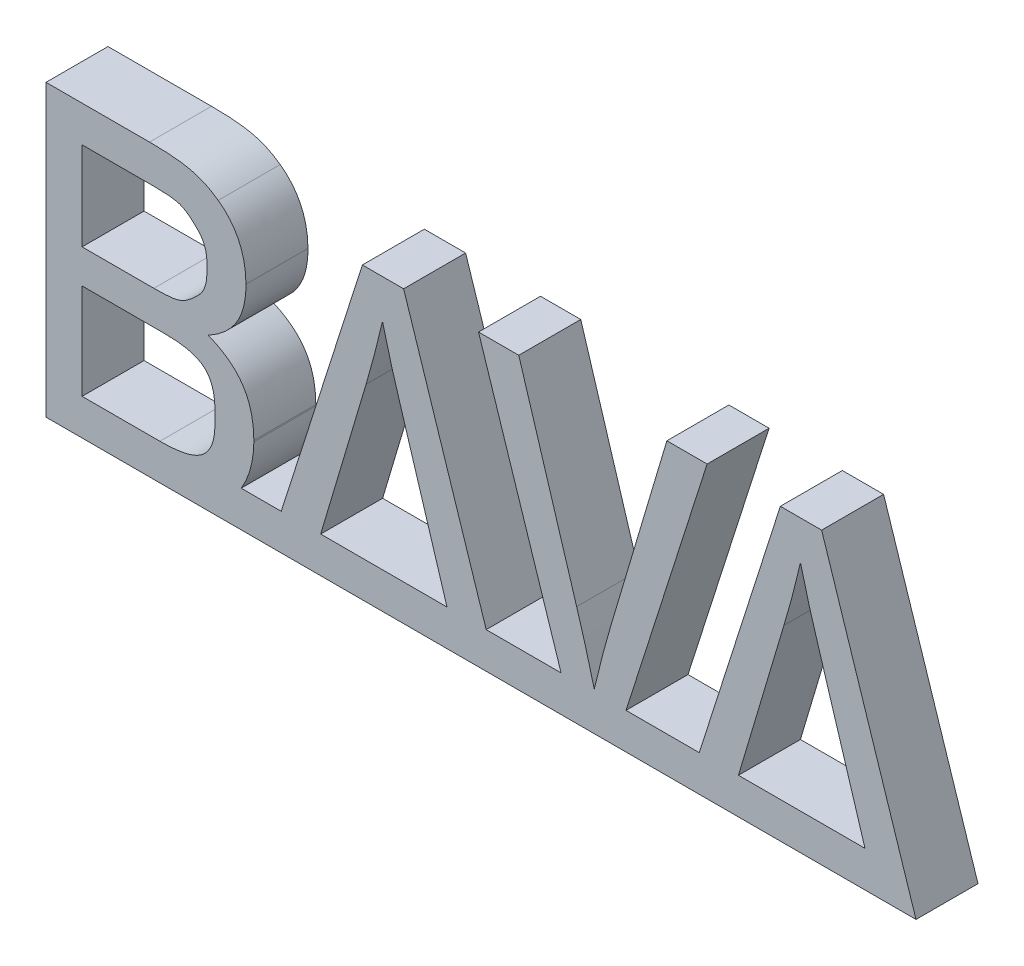
from build123d import *

# Parameters (mm, degrees)
BOSS_EXTRUDE1_DEPTH = 2


with BuildPart() as part:
    # Sketch1 → Boss-Extrude1 (new body)
    with BuildSketch(Plane.XY):
        with BuildLine():
            Line((-18.745582546, 31.006914048), (-21.79105099, 40.364252392))
            Line((-21.79105099, 40.364252392), (-23.123022137, 40.364252392))
            Line((-23.123022137, 40.364252392), (-25.740106044, 32.171592169))
            Line((-25.740106044, 32.171592169), (-28.102880037, 32.171592169))
            Line((-28.102880037, 32.171592169), (-25.485755278, 40.364252392))
            Line((-25.485755278, 40.364252392), (-26.78426782, 40.364252392))
            Line((-26.78426782, 40.364252392), (-28.598181785, 34.273274652))
            add(Edge.make_bspline(
                [(-28.598181785, 34.273274652), (-28.792274379, 33.597239241), (-28.906090832, 33.19565427), (-29.126942139, 32.251909163)],
                knots=[6, 6, 6, 6, 7, 7, 7, 7], degree=3))
            add(Edge.make_bspline(
                [(-29.126942139, 32.251909163), (-29.414792363, 33.316129761), (-29.448250968, 33.490163533), (-29.695901842, 34.273274652)],
                knots=[7, 7, 7, 7, 8, 8, 8, 8], degree=3))
            Line((-29.695901842, 34.273274652), (-31.563333235, 40.364252392))
            Line((-31.563333235, 40.364252392), (-32.861845777, 40.364252392))
            Line((-32.861845777, 40.364252392), (-30.197903482, 32.171592169))
            Line((-30.197903482, 32.171592169), (-32.614194903, 32.171592169))
            Line((-32.614194903, 32.171592169), (-35.278137198, 40.364252392))
            Line((-35.278137198, 40.364252392), (-36.610149199, 40.364252392))
            Line((-36.610149199, 40.364252392), (-39.227233105, 32.171592169))
            Line((-39.227233105, 32.171592169), (-40.519045756, 32.171592169))
            add(Edge.make_bspline(
                [(-40.519045756, 32.171592169), (-40.257995098, 32.593235961), (-40.110760894, 33.122037168), (-40.110760894, 33.69765591)],
                knots=[16, 16, 16, 16, 17, 17, 17, 17], degree=3))
            add(Edge.make_bspline(
                [(-40.110760894, 33.69765591), (-40.110760894, 34.82213468), (-40.572604036, 35.511569875), (-41.583307207, 35.913154846)],
                knots=[17, 17, 17, 17, 18, 18, 18, 18], degree=3))
            add(Edge.make_bspline(
                [(-41.583307207, 35.913154846), (-40.739937916, 36.374997988), (-40.365111659, 37.010874903), (-40.365111659, 37.947920118)],
                knots=[18, 18, 18, 18, 19, 19, 19, 19], degree=3))
            add(Edge.make_bspline(
                [(-40.365111659, 37.947920118), (-40.365111659, 38.764530696), (-40.679679744, 39.433866215), (-41.261998378, 39.842151078)],
                knots=[19, 19, 19, 19, 20, 20, 20, 20], degree=3))
            add(Edge.make_bspline(
                [(-41.261998378, 39.842151078), (-41.790799584, 40.23707701), (-42.353018543, 40.364252392), (-43.477497314, 40.364252392)],
                knots=[20, 20, 20, 20, 21, 21, 21, 21], degree=3))
            Line((-43.477497314, 40.364252392), (-46.817515873, 40.364252392))
            Line((-46.817515873, 40.364252392), (-46.817515873, 31.006914048))
            Line((-46.817515873, 31.006914048), (-18.745582546, 31.006914048))
        make_face()
        with BuildLine():
            Line((-43.142829554, 32.171592169), (-45.652837753, 32.171592169))
            Line((-45.652837753, 32.171592169), (-45.652837753, 35.257219109))
            Line((-45.652837753, 35.257219109), (-43.008995132, 35.257219109))
            add(Edge.make_bspline(
                [(-43.008995132, 35.257219109), (-41.958133464, 35.257219109), (-41.362415047, 34.708359081), (-41.362415047, 34.051267898), (-41.362415047, 33.725531232), (-41.362415054, 33.724414624)],
                knots=[0, 0, 0, 0, 1, 2, 2.003439864, 2.003439864, 2.003439864, 2.003439864], degree=3))
            add(Edge.make_bspline(
                [(-41.362415054, 33.724414624), (-41.362417047, 33.400922858), (-41.363577782, 32.75955684), (-42.038450458, 32.171592169), (-43.142829554, 32.171592169)],
                knots=[2.003439864, 2.003439864, 2.003439864, 2.003439864, 3, 4, 4, 4, 4], degree=3))
        make_face(mode=Mode.SUBTRACT)
        with BuildLine():
            Line((-33.87924884, 32.171592169), (-37.955479277, 32.171592169))
            Line((-37.955479277, 32.171592169), (-36.489632855, 37.091191897))
            add(Edge.make_bspline(
                [(-36.489632855, 37.091191897), (-36.295540261, 37.767227308), (-36.181764662, 38.17551217), (-35.960872501, 39.112598239)],
                knots=[1, 1, 1, 1, 2, 2, 2, 2], degree=3))
            add(Edge.make_bspline(
                [(-35.960872501, 39.112598239), (-35.679763022, 38.048336787), (-35.639604525, 37.881002907), (-35.391953651, 37.091191897)],
                knots=[2, 2, 2, 2, 3, 3, 3, 3], degree=3))
            Line((-35.391953651, 37.091191897), (-33.87924884, 32.171592169))
        make_face(mode=Mode.SUBTRACT)
        with BuildLine():
            add(Edge.make_bspline(
                [(-22.47374544, 39.112598239), (-22.19263596, 38.048336787), (-22.152477463, 37.881002907), (-21.904826589, 37.091191897)],
                knots=[1, 1, 1, 1, 2, 2, 2, 2], degree=3))
            Line((-21.904826589, 37.091191897), (-20.392121778, 32.171592169))
            Line((-20.392121778, 32.171592169), (-24.47509296, 32.171592169))
            Line((-24.47509296, 32.171592169), (-23.009246538, 37.091191897))
            add(Edge.make_bspline(
                [(-23.009246538, 37.091191897), (-22.808413199, 37.767227308), (-22.6946376, 38.17551217), (-22.47374544, 39.112598239)],
                knots=[0, 0, 0, 0, 1, 1, 1, 1], degree=3))
        make_face(mode=Mode.SUBTRACT)
        with BuildLine():
            Line((-45.652837753, 36.348239275), (-45.652837753, 39.199615125))
            Line((-45.652837753, 39.199615125), (-43.336963001, 39.199615125))
            add(Edge.make_bspline(
                [(-43.336963001, 39.199615125), (-42.7278448, 39.199615125), (-42.37024646, 39.09102995), (-42.179170008, 38.931701151), (-42.093373815, 38.855654373)],
                knots=[0, 0, 0, 0, 1, 1.908075185, 1.908075185, 1.908075185, 1.908075185], degree=3))
            add(Edge.make_bspline(
                [(-42.093373815, 38.855654373), (-42.083891518, 38.847731554), (-42.074504957, 38.839663032), (-42.065209172, 38.831447907)],
                knots=[1.967701589, 1.967701589, 1.967701589, 1.967701589, 2, 2, 2, 2], degree=3))
            add(Edge.make_bspline(
                [(-42.065209172, 38.831447907), (-42.05671789, 38.823784642), (-42.048329136, 38.815980397), (-42.040044694, 38.808039137)],
                knots=[2, 2, 2, 2, 2.030943823, 2.030943823, 2.030943823, 2.030943823], degree=3))
            add(Edge.make_bspline(
                [(-42.040044694, 38.808039137), (-41.956028804, 38.732525824), (-41.785347703, 38.570931339), (-41.623764076, 38.189616071), (-41.623466502, 37.918150912), (-41.623465709, 37.780586238)],
                knots=[2.097742568, 2.097742568, 2.097742568, 2.097742568, 3, 4, 4.994650719, 4.994650719, 4.994650719, 4.994650719], degree=3))
            add(Edge.make_bspline(
                [(-41.623465709, 37.780586238), (-41.623465704, 37.779846409), (-41.623465704, 37.640790138), (-41.623465704, 37.358942446), (-41.777399801, 36.970716406), (-41.969272715, 36.801149228), (-42.065209172, 36.71636564)],
                knots=[4.994650719, 4.994650719, 4.994650719, 4.994650719, 5, 6, 7, 8, 8, 8, 8], degree=3))
            add(Edge.make_bspline(
                [(-42.065209172, 36.71636564), (-42.161145629, 36.631582051), (-42.353018543, 36.462014874), (-42.7278448, 36.348239275), (-43.336963001, 36.348239275)],
                knots=[8, 8, 8, 8, 9, 10, 10, 10, 10], degree=3))
            Line((-43.336963001, 36.348239275), (-45.652837753, 36.348239275))
        make_face(mode=Mode.SUBTRACT)
    extrude(amount=BOSS_EXTRUDE1_DEPTH)


solid = part.part
